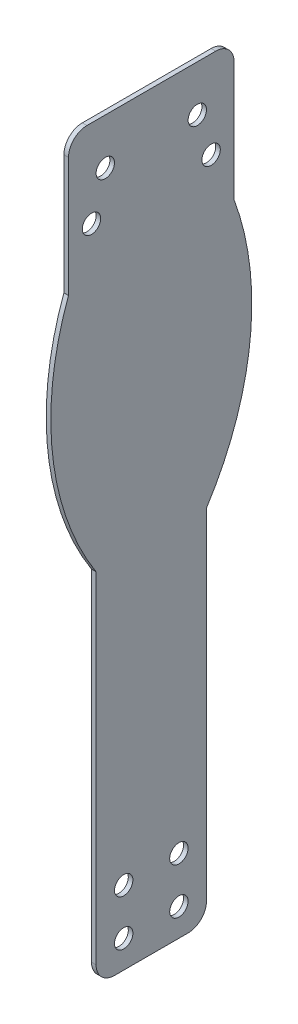
from build123d import *

# Parameters (mm, degrees)
BOSS_EXTRUDE1_DEPTH      = 1
F_4_0_4_DIAMETER_HOLE3_D = 4
F_4_0_4_DIAMETER_HOLE2_D = 4
F_4_0_4_DIAMETER_HOLE1_D = 4
LPATTERN1_COUNT          = 2
LPATTERN1_PITCH          = 10
FILLET1_R                = 4


with BuildPart() as part:
    # Sketch1 → Boss-Extrude1 (new body)
    with BuildSketch(Plane(origin=(0, 0, 0), x_dir=(0, 0, -1), z_dir=(1, 0, 0))):
        with BuildLine():
            Line((12, -163), (12, -85))
            ThreePointArc((12, -85), (21.475099597, -58.206374501), (18, -30))
            Line((18, -30), (18, 0))
            Line((18, 0), (-18, 0))
            Line((-18, 0), (-18, -30))
            ThreePointArc((-18, -30), (-21.475099597, -58.206374501), (-12, -85))
            Line((-12, -85), (-12, -163))
            Line((-12, -163), (12, -163))
        make_face()
    extrude(amount=BOSS_EXTRUDE1_DEPTH)

    # Ø4.0 (4) Diameter Hole3 (through all)
    with Locations(Plane.ZY):
        with Locations((10, -10), (-10, -10)):
            Hole(F_4_0_4_DIAMETER_HOLE3_D / 2)

    # Ø4.0 (4) Diameter Hole2 (through all)
    with Locations(Plane.ZY):
        with Locations((-13, -19), (13, -19)):
            Hole(F_4_0_4_DIAMETER_HOLE2_D / 2)

    # Ø4.0 (4) Diameter Hole1 (through all)
    with Locations(Plane(origin=(1, 0, 0), x_dir=(0, 0, -1), z_dir=(1, 0, 0))):
        with Locations((-6, -157), (6, -157)):
            f_4_0_4_diameter_hole1 = Hole(F_4_0_4_DIAMETER_HOLE1_D / 2)

    # LPattern1: Ø4.0 (4) Diameter Hole1 ×2
    with Locations(*[(0, i * LPATTERN1_PITCH, 0) for i in range(1, LPATTERN1_COUNT)]):
        add(f_4_0_4_diameter_hole1, mode=Mode.SUBTRACT)

    # Fillet1
    fillet1_edges = [part.edges().sort_by_distance(p)[0] for p in [
        (0.5, 0, 18),
        (0.5, 0, -18),
        (0.5, -163, -12),
        (0.5, -163, 12),
    ]]
    fillet(fillet1_edges, radius=FILLET1_R)


solid = part.part
